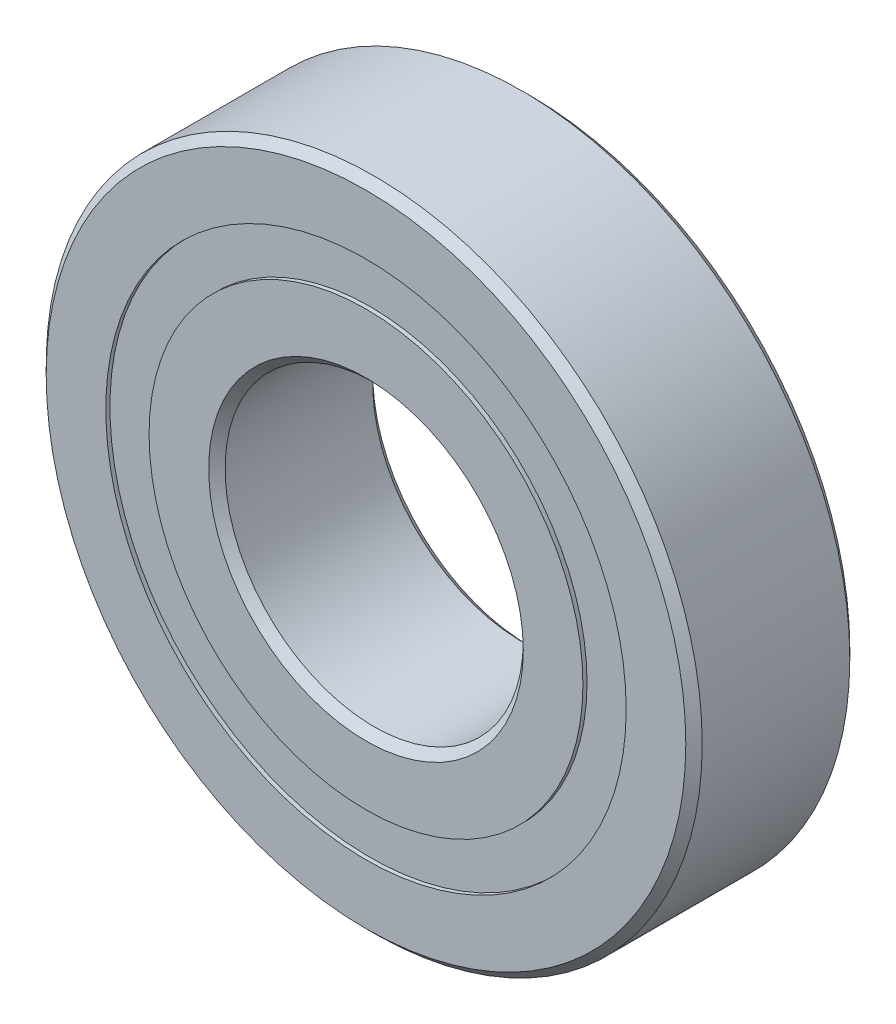
from build123d import *

# Parameters (mm, degrees)
CIRPATTERN1_COUNT = 10
SKETCH5_W         = 1.891165769
SKETCH5_H         = 2.302747252


with BuildPart() as part:
    # Sketch1 → Revolve1 (revolve)
    with BuildSketch(Plane(origin=(0, 0, 0), x_dir=(0, 0, -1), z_dir=(1, 0, 0))):
        with BuildLine():
            Line((3.9290625, 17.4625), (-3.9290625, 17.4625))
            Line((-3.9290625, 17.4625), (-4.365625, 17.0259375))
            Line((-4.365625, 17.0259375), (-4.365625, 13.851373626))
            Line((-4.365625, 13.851373626), (-1.940277778, 13.851373626))
            ThreePointArc((-1.940277778, 13.851373626), (0, 14.956177981), (1.940277778, 13.851373626))
            Line((1.940277778, 13.851373626), (4.365625, 13.851373626))
            Line((4.365625, 13.851373626), (4.365625, 17.0259375))
            Line((4.365625, 17.0259375), (3.9290625, 17.4625))
        make_face()
    revolve(axis=Axis((0, 0, 4.365625), (0, 0, -1)))


with BuildPart() as body_2:
    # Sketch3 → Revolve3 (revolve)
    with BuildSketch(Plane(origin=(0, 0, 0), x_dir=(0, 0, -1), z_dir=(1, 0, 0))):
        with BuildLine():
            Line((-4.365625, 11.548626374), (-1.940277778, 11.548626374))
            ThreePointArc((-1.940277778, 11.548626374), (0, 10.443822019), (1.940277778, 11.548626374))
            Line((1.940277778, 11.548626374), (4.365625, 11.548626374))
            Line((4.365625, 11.548626374), (4.365625, 8.3740625))
            Line((4.365625, 8.3740625), (3.9290625, 7.9375))
            Line((3.9290625, 7.9375), (-3.9290625, 7.9375))
            Line((-3.9290625, 7.9375), (-4.365625, 8.3740625))
            Line((-4.365625, 8.3740625), (-4.365625, 11.548626374))
        make_face()
    revolve(axis=Axis((0, 0, 4.365625), (0, 0, -1)))


with BuildPart() as body_3:
    # Sketch4 → Revolve4 (revolve)
    with BuildSketch(Plane(origin=(0, 0, 0), x_dir=(0, 0, -1), z_dir=(1, 0, 0))):
        with BuildLine():
            Line((-2.256177981, 12.7), (2.256177981, 12.7))
            ThreePointArc((2.256177981, 12.7), (0, 14.956177981), (-2.256177981, 12.7))
        make_face()
    revolve(axis=Axis((0, 12.7, 2.256177981), (0, 0, -1)))


with BuildPart() as cirpattern1_1:
    # CirPattern1: pattern copy
    add(body_3.part.rotate(Axis((0, 0, -4.365625), (0, 0, 1)), 1 * 360 / CIRPATTERN1_COUNT))


with BuildPart() as cirpattern1_2:
    # CirPattern1: pattern copy
    add(body_3.part.rotate(Axis((0, 0, -4.365625), (0, 0, 1)), 2 * 360 / CIRPATTERN1_COUNT))


with BuildPart() as cirpattern1_3:
    # CirPattern1: pattern copy
    add(body_3.part.rotate(Axis((0, 0, -4.365625), (0, 0, 1)), 3 * 360 / CIRPATTERN1_COUNT))


with BuildPart() as cirpattern1_4:
    # CirPattern1: pattern copy
    add(body_3.part.rotate(Axis((0, 0, -4.365625), (0, 0, 1)), 4 * 360 / CIRPATTERN1_COUNT))


with BuildPart() as cirpattern1_5:
    # CirPattern1: pattern copy
    add(body_3.part.rotate(Axis((0, 0, -4.365625), (0, 0, 1)), 5 * 360 / CIRPATTERN1_COUNT))


with BuildPart() as cirpattern1_6:
    # CirPattern1: pattern copy
    add(body_3.part.rotate(Axis((0, 0, -4.365625), (0, 0, 1)), 6 * 360 / CIRPATTERN1_COUNT))


with BuildPart() as cirpattern1_7:
    # CirPattern1: pattern copy
    add(body_3.part.rotate(Axis((0, 0, -4.365625), (0, 0, 1)), 7 * 360 / CIRPATTERN1_COUNT))


with BuildPart() as cirpattern1_8:
    # CirPattern1: pattern copy
    add(body_3.part.rotate(Axis((0, 0, -4.365625), (0, 0, 1)), 8 * 360 / CIRPATTERN1_COUNT))


with BuildPart() as cirpattern1_9:
    # CirPattern1: pattern copy
    add(body_3.part.rotate(Axis((0, 0, -4.365625), (0, 0, 1)), 9 * 360 / CIRPATTERN1_COUNT))


with BuildPart() as body_13:
    # Sketch5 → Revolve5 (revolve)
    with BuildSketch(Plane(origin=(0, 0, 0), x_dir=(0, 0, -1), z_dir=(1, 0, 0))):
        with Locations((-3.201760865, 12.7)):
            Rectangle(SKETCH5_W, SKETCH5_H)
        with Locations((3.201760865, 12.7)):
            Rectangle(SKETCH5_W, SKETCH5_H)
    revolve(axis=Axis((0, 0, 4.365625), (0, 0, -1)))


solid = Compound([part.part, body_2.part, body_3.part, cirpattern1_1.part, cirpattern1_2.part, cirpattern1_3.part, cirpattern1_4.part, cirpattern1_5.part, cirpattern1_6.part, cirpattern1_7.part, cirpattern1_8.part, cirpattern1_9.part, body_13.part])
